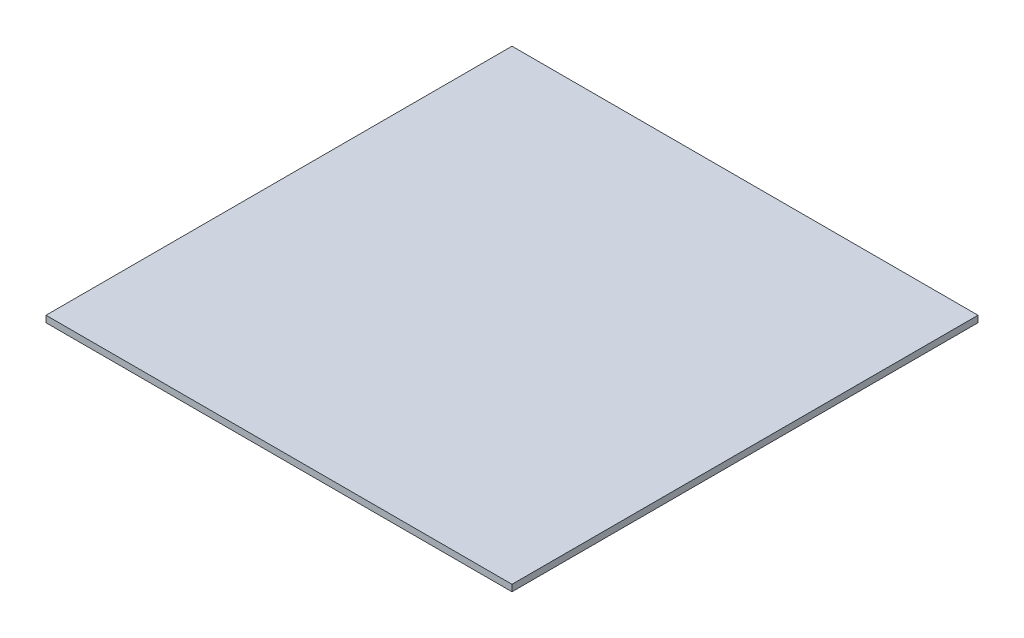
from build123d import *

# Parameters (mm, degrees)
SKETCH1_W           = 214
SKETCH1_H           = 214
BOSS_EXTRUDE1_DEPTH = 3


with BuildPart() as part:
    # Sketch1 → Boss-Extrude1 (new body)
    with BuildSketch(Plane(origin=(0, 0, 0), x_dir=(1, 0, 0), z_dir=(0, 1, 0))):
        Rectangle(SKETCH1_W, SKETCH1_H)
    extrude(amount=BOSS_EXTRUDE1_DEPTH)


solid = part.part
